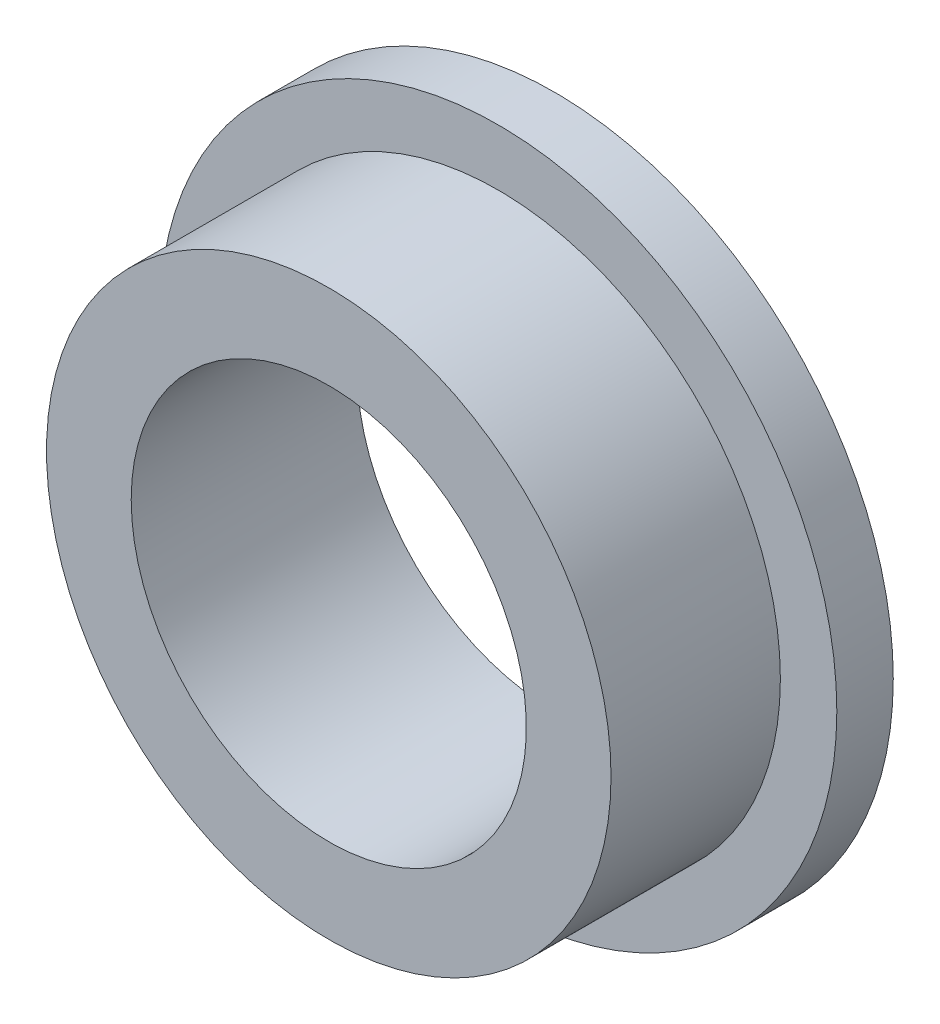
from build123d import *

# Parameters (mm, degrees)
SKETCH_2_R          = 6
EXTRUDE_1_DEPTH     = 1
SKETCH_3_R          = 5
EXTRUDE_2_DEPTH     = 3
SKETCH_4_R          = 3.5
CUT_EXTRUDE_1_DEPTH = 10.38083152


with BuildPart() as part:
    # Эскиз2 → Бобышка-Вытянуть1 (new body)
    with BuildSketch(Plane.XY):
        Circle(SKETCH_2_R)
    extrude(amount=EXTRUDE_1_DEPTH)

    # Эскиз3 → Бобышка-Вытянуть2 (add)
    with BuildSketch(Plane.XY.offset(1)):
        Circle(SKETCH_3_R)
    extrude(amount=EXTRUDE_2_DEPTH)

    # Эскиз4 → Вырез-Вытянуть1 (cut, through all)
    with BuildSketch(Plane(origin=(0, 0, 0), x_dir=(-1, 0, 0), z_dir=(0, 0, -1))):
        Circle(SKETCH_4_R)
    extrude(amount=-CUT_EXTRUDE_1_DEPTH, mode=Mode.SUBTRACT)


solid = part.part
